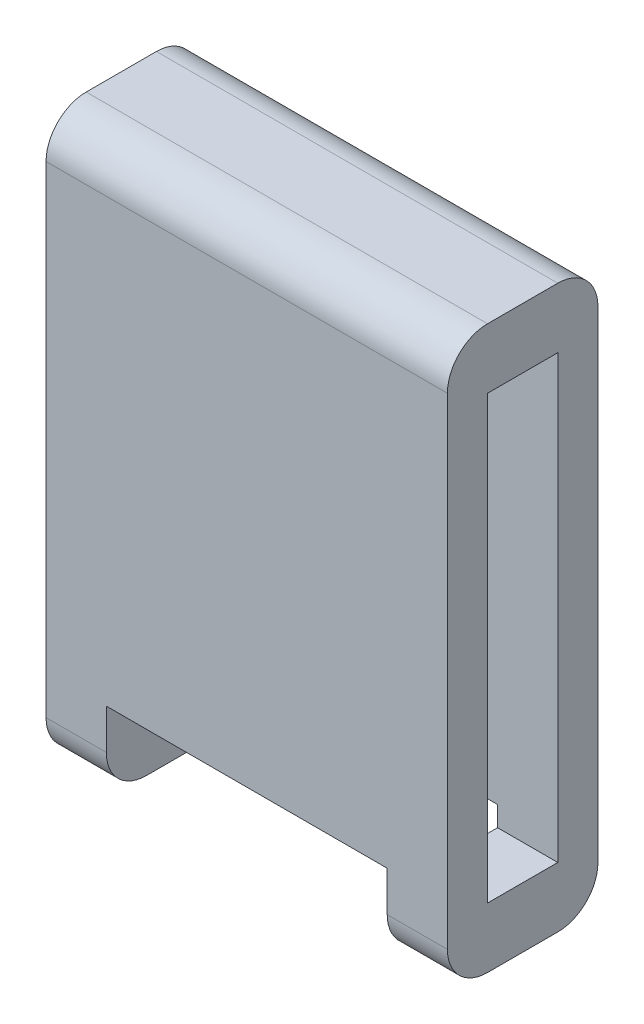
from build123d import *

# Parameters (mm, degrees)
SKETCH2_W           = 42
SKETCH2_H           = 8.4
BOSS_EXTRUDE1_DEPTH = 2
SKETCH3_W           = 3.55
SKETCH3_H           = 8.4
SKETCH3_W_2         = 10
BOSS_EXTRUDE2_DEPTH = 2
FILLET1_R           = 2
SKETCH4_R           = 1
CUT_EXTRUDE1_DEPTH  = 2
SKETCH5_W           = 20
SKETCH5_H           = 28
BOSS_EXTRUDE3_DEPTH = 7.5
FILLET2_R           = 2
SKETCH6_W           = 3.5
SKETCH6_H           = 22
CUT_EXTRUDE2_DEPTH  = 20
SKETCH7_W           = 44.314231138
SKETCH7_H           = 10.974489351
CUT_EXTRUDE3_DEPTH  = 4
SKETCH8_W           = 14
SKETCH8_H           = 4
CUT_EXTRUDE4_DEPTH  = 10


with BuildPart() as part:
    # Sketch2 → Boss-Extrude1 (new body)
    with BuildSketch(Plane.XY.offset(-7.754792002)):
        Rectangle(SKETCH2_W, SKETCH2_H)
    extrude(amount=BOSS_EXTRUDE1_DEPTH)

    # Sketch3 → Boss-Extrude2 (add)
    with BuildSketch(Plane.XY.offset(-5.754792002)):
        with Locations((-8.975, 0)):
            Rectangle(SKETCH3_W, SKETCH3_H)
        with Locations((8.975, 0)):
            Rectangle(SKETCH3_W, SKETCH3_H)
        Rectangle(SKETCH3_W_2, SKETCH3_H)
    extrude(amount=BOSS_EXTRUDE2_DEPTH)

    # Fillet1
    fillet1_edges = [part.edges().sort_by_distance(p)[0] for p in [
        (-21, 4.2, -6.754792002),
        (21, 4.2, -6.754792002),
        (21, -4.2, -6.754792002),
        (-21, -4.2, -6.754792002),
    ]]
    fillet(fillet1_edges, radius=FILLET1_R)

    # Sketch4 → Cut-Extrude1 (cut)
    with BuildSketch(Plane.XY.offset(-5.754792002)):
        with Locations((-17.75, 0)):
            Circle(SKETCH4_R)
        with Locations((17.75, 0)):
            Circle(SKETCH4_R)
    extrude(amount=-CUT_EXTRUDE1_DEPTH, mode=Mode.SUBTRACT)

    # Sketch5 → Boss-Extrude3 (add)
    with BuildSketch(Plane(origin=(0, 0, -7.754792002), x_dir=(-1, 0, 0), z_dir=(0, 0, -1))):
        Rectangle(SKETCH5_W, SKETCH5_H)
    extrude(amount=BOSS_EXTRUDE3_DEPTH)

    # Fillet2
    fillet2_edges = [part.edges().sort_by_distance(p)[0] for p in [
        (0, 14, -7.754792002),
        (0, -14, -7.754792002),
        (0, 14, -15.254792002),
        (0, -14, -15.254792002),
    ]]
    fillet(fillet2_edges, radius=FILLET2_R)

    # Sketch6 → Cut-Extrude2 (cut)
    with BuildSketch(Plane.ZY.offset(10)):
        with Locations((-11.504792002, 0)):
            Rectangle(SKETCH6_W, SKETCH6_H)
    extrude(amount=-CUT_EXTRUDE2_DEPTH, mode=Mode.SUBTRACT)

    # Sketch7 → Cut-Extrude3 (cut)
    with BuildSketch(Plane.XY.offset(-3.754792002)):
        with Locations((-0.219821089, -0.04579799)):
            Rectangle(SKETCH7_W, SKETCH7_H)
    extrude(amount=-CUT_EXTRUDE3_DEPTH, mode=Mode.SUBTRACT)

    # Sketch8 → Cut-Extrude4 (cut)
    with BuildSketch(Plane.XY.offset(-7.754792002)):
        with Locations((0, -12)):
            Rectangle(SKETCH8_W, SKETCH8_H)
    extrude(amount=-CUT_EXTRUDE4_DEPTH, mode=Mode.SUBTRACT)


solid = part.part
